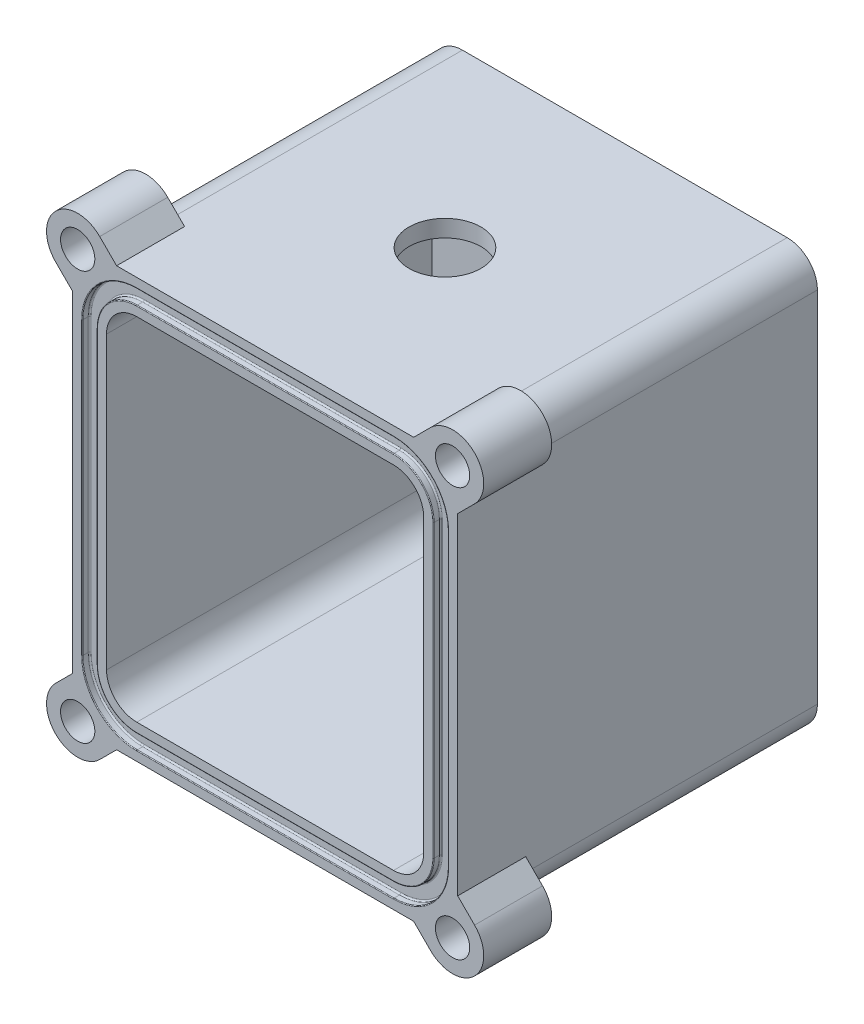
from build123d import *

# Parameters (mm, degrees)
BOSS_EXTRUDE1_DEPTH     = 31.75
SHELL1_T                = -6
FILLET1_R               = 5.334
CUT_EXTRUDE1_DEPTH      = 1.2954
FILLET2_R               = 0.254
FILLET3_R               = 0.127
BOSS_EXTRUDE2_DEPTH     = 12
SKETCH4_R               = 3.025
CUT_EXTRUDE2_DEPTH      = 9
MIRROR2_COPY_1_DEPTH    = 12
MIRROR2_COPY_2_SKETCH_R = 3.025
MIRROR2_COPY_2_DEPTH    = 9
CUT_EXTRUDE3_DEPTH      = 6
CUT_EXTRUDE4_START      = -3
SKETCH7_R               = 11.43
SKETCH7_R_2             = 6.35
CUT_EXTRUDE4_DEPTH      = 3


with BuildPart() as part:
    # Sketch1 → Boss-Extrude1 (new, symmetric)
    with BuildSketch(Plane.XY):
        Polygon((-34, -37), (-34, -16.68), (-34, 16.68), (-34, 37), (34, 37), (34, -37), align=None)
    extrude(amount=BOSS_EXTRUDE1_DEPTH, both=True)

    # Shell1
    shell1_openings = [part.faces().sort_by_distance(p)[0] for p in [
        (0, 0, 31.75),
    ]]
    offset(amount=SHELL1_T, openings=shell1_openings, kind=Kind.INTERSECTION)

    # Fillet1
    fillet1_edges = [part.edges().sort_by_distance(p)[0] for p in [
        (-34, -37, 0),
        (-34, 37, 0),
        (34, 37, 0),
        (34, -37, 0),
        (-28, -31, 3),
        (28, -31, 3),
        (28, 31, 3),
        (-28, 31, 3),
    ]]
    fillet(fillet1_edges, radius=FILLET1_R)

    # Sketch2 → Cut-Extrude1 (cut)
    with BuildSketch(Plane.XY.offset(31.75)):
        with BuildLine():
            Line((32.2827, -25.666), (32.2827, 25.666))
            ThreePointArc((32.2827, 25.666), (29.466033783, 32.466033783), (22.666, 35.2827))
            Line((22.666, 35.2827), (-22.666, 35.2827))
            ThreePointArc((-22.666, 35.2827), (-29.466033783, 32.466033783), (-32.2827, 25.666))
            Line((-32.2827, 25.666), (-32.2827, -25.666))
            ThreePointArc((-32.2827, -25.666), (-29.466033783, -32.466033783), (-22.666, -35.2827))
            Line((-22.666, -35.2827), (22.666, -35.2827))
            ThreePointArc((22.666, -35.2827), (29.466033783, -32.466033783), (32.2827, -25.666))
        make_face()
        with BuildLine():
            Line((-29.7173, 25.666), (-29.7173, -25.666))
            ThreePointArc((-29.7173, -25.666), (-27.652022046, -30.652022046), (-22.666, -32.7173))
            Line((-22.666, -32.7173), (22.666, -32.7173))
            ThreePointArc((22.666, -32.7173), (27.652022046, -30.652022046), (29.7173, -25.666))
            Line((29.7173, -25.666), (29.7173, 25.666))
            ThreePointArc((29.7173, 25.666), (27.652022046, 30.652022046), (22.666, 32.7173))
            Line((22.666, 32.7173), (-22.666, 32.7173))
            ThreePointArc((-22.666, 32.7173), (-27.652022046, 30.652022046), (-29.7173, 25.666))
        make_face(mode=Mode.SUBTRACT)
    extrude(amount=-CUT_EXTRUDE1_DEPTH, mode=Mode.SUBTRACT)

    # Fillet2
    fillet2_edges = [part.edges().sort_by_distance(p)[0] for p in [
        (29.466033783, -32.466033783, 30.4546),
        (0, -35.2827, 30.4546),
        (-29.466033783, -32.466033783, 30.4546),
        (-32.2827, 0, 30.4546),
        (-29.466033783, 32.466033783, 30.4546),
        (0, 35.2827, 30.4546),
        (29.466033783, 32.466033783, 30.4546),
        (32.2827, 0, 30.4546),
        (0, 32.7173, 30.4546),
        (-27.652022046, 30.652022046, 30.4546),
        (-29.7173, 0, 30.4546),
        (-27.652022046, -30.652022046, 30.4546),
        (0, -32.7173, 30.4546),
        (27.652022046, -30.652022046, 30.4546),
        (29.7173, 0, 30.4546),
        (27.652022046, 30.652022046, 30.4546),
    ]]
    fillet(fillet2_edges, radius=FILLET2_R)

    # Fillet3
    fillet3_edges = [part.edges().sort_by_distance(p)[0] for p in [
        (29.466033783, -32.466033783, 31.75),
        (32.2827, 0, 31.75),
        (29.466033783, 32.466033783, 31.75),
        (0, 35.2827, 31.75),
        (-29.466033783, 32.466033783, 31.75),
        (-32.2827, 0, 31.75),
        (-29.466033783, -32.466033783, 31.75),
        (0, -35.2827, 31.75),
        (-27.652022046, 30.652022046, 31.75),
        (0, 32.7173, 31.75),
        (27.652022046, 30.652022046, 31.75),
        (29.7173, 0, 31.75),
        (27.652022046, -30.652022046, 31.75),
        (0, -32.7173, 31.75),
        (-27.652022046, -30.652022046, 31.75),
        (-29.7173, 0, 31.75),
    ]]
    fillet(fillet3_edges, radius=FILLET3_R)

    # Sketch3 → Boss-Extrude2 (add)
    with BuildSketch(Plane.XY.offset(31.75)):
        with BuildLine():
            Line((34, -29.221825407), (34, -31.666))
            ThreePointArc((34, -31.666), (32.437707571, -35.437707571), (28.666, -37))
            Line((28.666, -37), (26.221825407, -37))
            Line((26.221825407, -37), (29.202282953, -39.980457546))
            ThreePointArc((29.202282953, -39.980457546), (36.980457546, -39.980457546), (36.980457546, -32.202282953))
            Line((36.980457546, -32.202282953), (34, -29.221825407))
        make_face()
    boss_extrude2 = extrude(amount=-BOSS_EXTRUDE2_DEPTH)

    # Sketch4 → Cut-Extrude2 (cut)
    with BuildSketch(Plane.XY.offset(31.75)):
        with Locations((33.09137025, -36.09137025)):
            Circle(SKETCH4_R)
    cut_extrude2 = extrude(amount=-CUT_EXTRUDE2_DEPTH, mode=Mode.SUBTRACT)

    # Mirror1: Boss-Extrude2, Cut-Extrude2 across plane
    add(boss_extrude2.mirror(Plane.ZX))
    add(cut_extrude2.mirror(Plane.ZX), mode=Mode.SUBTRACT)

    # Mirror2: Boss-Extrude2, Cut-Extrude2 across plane
    add(boss_extrude2.mirror(Plane(origin=(0, 0, 0), x_dir=(0, 0, 1), z_dir=(1, 0, 0))))
    add(cut_extrude2.mirror(Plane(origin=(0, 0, 0), x_dir=(0, 0, 1), z_dir=(1, 0, 0))), mode=Mode.SUBTRACT)

    # Mirror2 copy 1 sketch → Mirror2 copy 1 (add)
    with BuildSketch(Plane(origin=(0, 0, 31.75), x_dir=(-1, 0, 0), z_dir=(0, 0, 1))):
        with BuildLine():
            Line((34, -29.221825407), (34, -31.666))
            ThreePointArc((34, -31.666), (32.437707571, -35.437707571), (28.666, -37))
            Line((28.666, -37), (26.221825407, -37))
            Line((26.221825407, -37), (29.202282953, -39.980457546))
            ThreePointArc((29.202282953, -39.980457546), (36.980457546, -39.980457546), (36.980457546, -32.202282953))
            Line((36.980457546, -32.202282953), (34, -29.221825407))
        make_face()
    extrude(amount=-MIRROR2_COPY_1_DEPTH)

    # Mirror2 copy 2 sketch → Mirror2 copy 2 (cut)
    with BuildSketch(Plane(origin=(0, 0, 31.75), x_dir=(-1, 0, 0), z_dir=(0, 0, 1))):
        with Locations((33.09137025, -36.09137025)):
            Circle(MIRROR2_COPY_2_SKETCH_R)
    extrude(amount=-MIRROR2_COPY_2_DEPTH, mode=Mode.SUBTRACT)

    # Sketch6 → Cut-Extrude3 (cut)
    with BuildSketch(Plane(origin=(0, 37, 0), x_dir=(1, 0, 0), z_dir=(0, 1, 0))):
        with BuildLine():
            ThreePointArc((0, 6.35), (-6.35, 0), (0, -6.35))
            Line((0, -6.35), (0, 6.35))
        make_face()
        with BuildLine():
            Line((0, 6.35), (0, -6.35))
            ThreePointArc((0, -6.35), (4.490128061, -4.490128061), (6.35, 0))
            ThreePointArc((6.35, 0), (4.490128061, 4.490128061), (0, 6.35))
        make_face()
    extrude(amount=-CUT_EXTRUDE3_DEPTH, mode=Mode.SUBTRACT)

    # Sketch7 → Cut-Extrude4 (cut)
    with BuildSketch(Plane.XZ.offset(-31).offset(CUT_EXTRUDE4_START)):
        Circle(SKETCH7_R)
        with Locations(Location((0, 0, 0), (0, 0, 180))):
            Circle(SKETCH7_R_2, mode=Mode.SUBTRACT)
    extrude(amount=CUT_EXTRUDE4_DEPTH, mode=Mode.SUBTRACT)


solid = part.part
